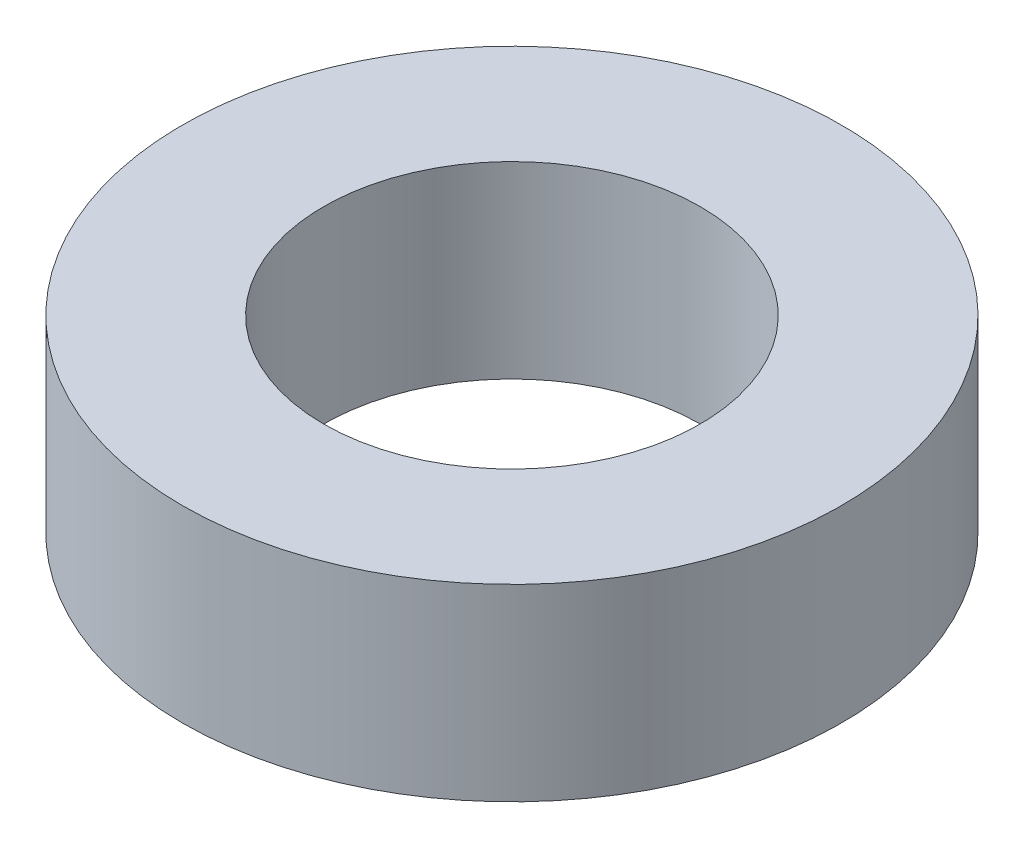
from build123d import *

# Parameters (mm, degrees)
SKETCH1_R           = 17.5
SKETCH1_R_2         = 10
BOSS_EXTRUDE1_DEPTH = 10


with BuildPart() as part:
    # Sketch1 → Boss-Extrude1 (new body)
    with BuildSketch(Plane(origin=(0, 0, 0), x_dir=(1, 0, 0), z_dir=(0, 1, 0))):
        with Locations(Location((0, 0, 0), (0, 0, 270))):
            Circle(SKETCH1_R)
        with Locations(Location((0, 0, 0), (0, 0, 270))):
            Circle(SKETCH1_R_2, mode=Mode.SUBTRACT)
    extrude(amount=BOSS_EXTRUDE1_DEPTH)


solid = part.part
